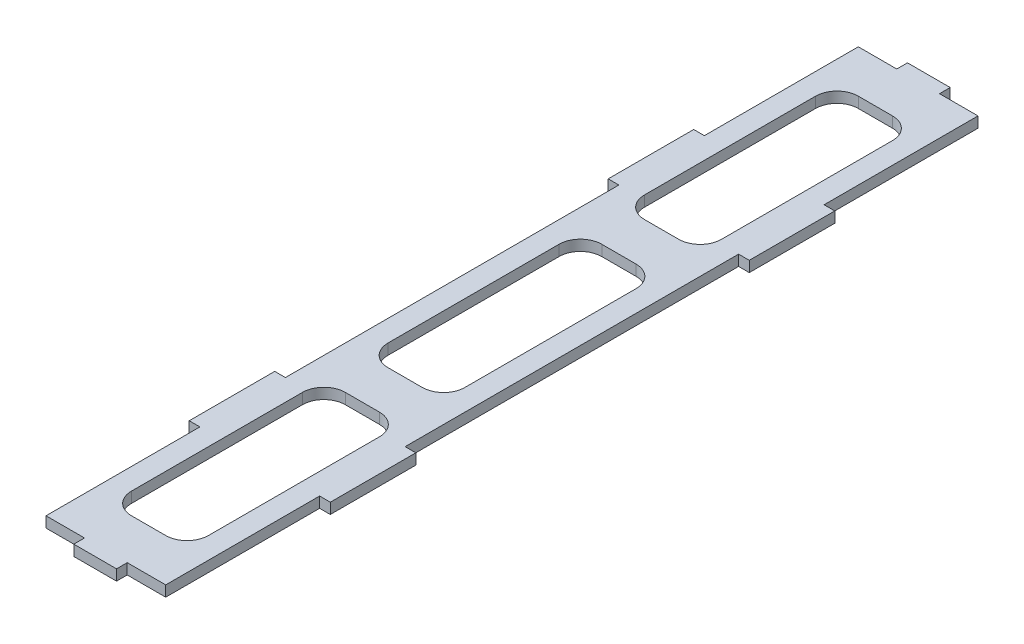
from build123d import *

# Parameters (mm, degrees)
BOSS_EXTRUDE1_DEPTH = 3.175
SKETCH3_W           = 22.86
SKETCH3_H           = 63.5
CUT_EXTRUDE2_DEPTH  = 3.175
FILLET3_R           = 6.35


with BuildPart() as part:
    # Sketch2 → Boss-Extrude1 (new body)
    with BuildSketch(Plane(origin=(0, 0, 0), x_dir=(1, 0, 0), z_dir=(0, 1, 0))):
        Polygon((35.56, 0), (35.56, 45.72), (38.735, 45.72), (38.735, 71.12), (35.56, 71.12), (35.56, 170.18), (38.735, 170.18), (38.735, 195.58), (35.56, 195.58), (35.56, 241.3), (24.13, 241.3), (24.13, 244.475), (11.43, 244.475), (11.43, 241.3), (0, 241.3), (0, 195.58), (-3.175, 195.58), (-3.175, 170.18), (0, 170.18), (0, 71.12), (-3.175, 71.12), (-3.175, 45.72), (0, 45.72), (0, 0), (11.43, 0), (11.43, -3.175), (24.13, -3.175), (24.13, 0), align=None)
    extrude(amount=BOSS_EXTRUDE1_DEPTH)

    # Sketch3 → Cut-Extrude2 (cut)
    with BuildSketch(Plane(origin=(0, 0, 0), x_dir=(1, 0, 0), z_dir=(0, 1, 0))):
        with Locations((17.78, 44.45)):
            Rectangle(SKETCH3_W, SKETCH3_H)
        with Locations((17.78, 120.65)):
            Rectangle(SKETCH3_W, SKETCH3_H)
        with Locations((17.78, 196.85)):
            Rectangle(SKETCH3_W, SKETCH3_H)
    extrude(amount=CUT_EXTRUDE2_DEPTH, mode=Mode.SUBTRACT)

    # Fillet3
    fillet3_edges = [part.edges().sort_by_distance(p)[0] for p in [
        (29.21, 1.5875, -88.9),
        (29.21, 1.5875, -152.4),
        (6.35, 1.5875, -152.4),
        (6.35, 1.5875, -88.9),
        (6.35, 1.5875, -165.1),
        (29.21, 1.5875, -165.1),
        (29.21, 1.5875, -228.6),
        (6.35, 1.5875, -228.6),
        (29.21, 1.5875, -76.2),
        (6.35, 1.5875, -76.2),
        (6.35, 1.5875, -12.7),
        (29.21, 1.5875, -12.7),
    ]]
    fillet(fillet3_edges, radius=FILLET3_R)


solid = part.part
